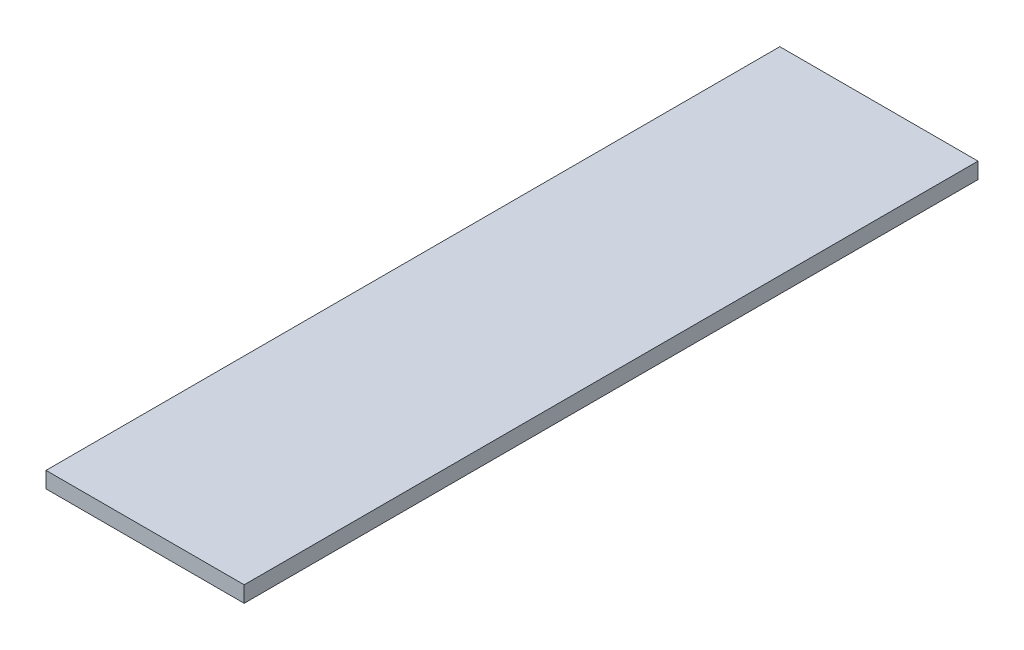
from build123d import *

# Parameters (mm, degrees)
SKETCH1_W           = 74
SKETCH1_H           = 274
BOSS_EXTRUDE1_DEPTH = 6


with BuildPart() as part:
    # Sketch1 → Boss-Extrude1 (new body)
    with BuildSketch(Plane(origin=(0, 0, 0), x_dir=(1, 0, 0), z_dir=(0, 1, 0))):
        Rectangle(SKETCH1_W, SKETCH1_H)
    extrude(amount=BOSS_EXTRUDE1_DEPTH)


solid = part.part
